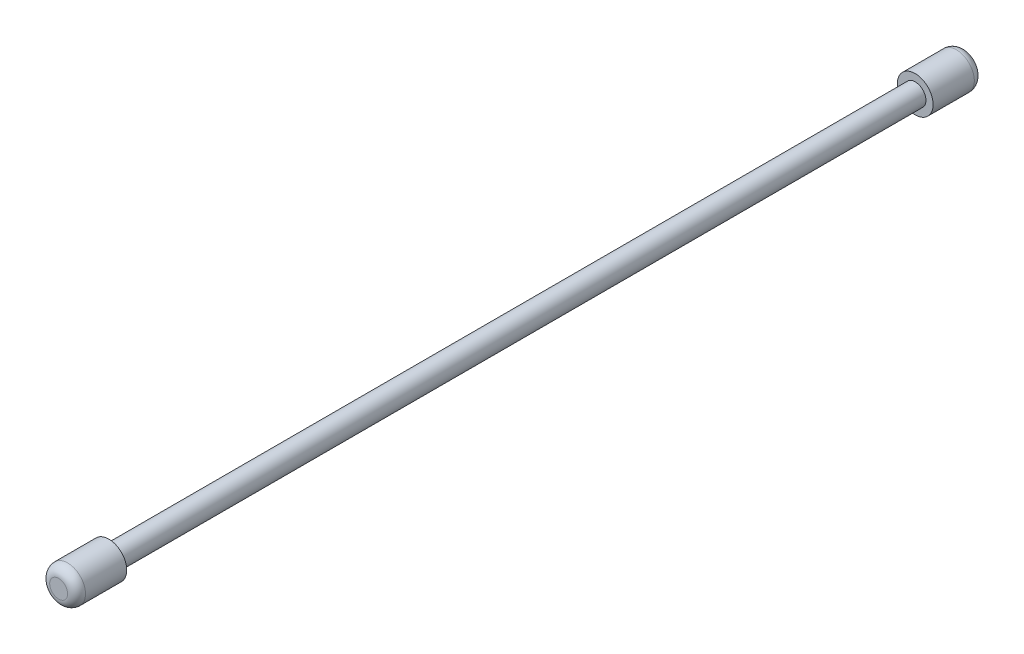
from build123d import *

# Parameters (mm, degrees)
BOSS_EXTRUDE1_DEPTH      = 250
BOSS_EXTRUDE1_DEPTH_BACK = 250
SKETCH1_R                = 6
SKETCH1_R_2              = 5
BOSS_EXTRUDE2_START      = -25
SKETCH2_R                = 10
BOSS_EXTRUDE2_DEPTH      = 28
FILLET1_R                = 5
FILLET2_R                = 5


with BuildPart() as part:
    # Sketch1 → Boss-Extrude1 (new, two sides: drawn at the far end of the back side and taken through both)
    with BuildSketch(Plane.XY.offset(-BOSS_EXTRUDE1_DEPTH_BACK)):
        Circle(SKETCH1_R)
        Circle(SKETCH1_R_2, mode=Mode.SUBTRACT)
    extrude(amount=BOSS_EXTRUDE1_DEPTH + BOSS_EXTRUDE1_DEPTH_BACK)

    # Sketch2 → Boss-Extrude2 (add)
    with BuildSketch(Plane.XY.offset(250).offset(BOSS_EXTRUDE2_START)):
        Circle(SKETCH2_R)
    boss_extrude2 = extrude(amount=BOSS_EXTRUDE2_DEPTH)

    # Fillet1
    fillet1_edges = [part.edges().sort_by_distance(p)[0] for p in [
        (-10, 0, 253),
    ]]
    fillet(fillet1_edges, radius=FILLET1_R)

    # Mirror2: Boss-Extrude2 across plane
    add(boss_extrude2.mirror(Plane.XY))

    # Fillet2
    fillet2_edges = [part.edges().sort_by_distance(p)[0] for p in [
        (-10, 0, -253),
    ]]
    fillet(fillet2_edges, radius=FILLET2_R)


solid = part.part
